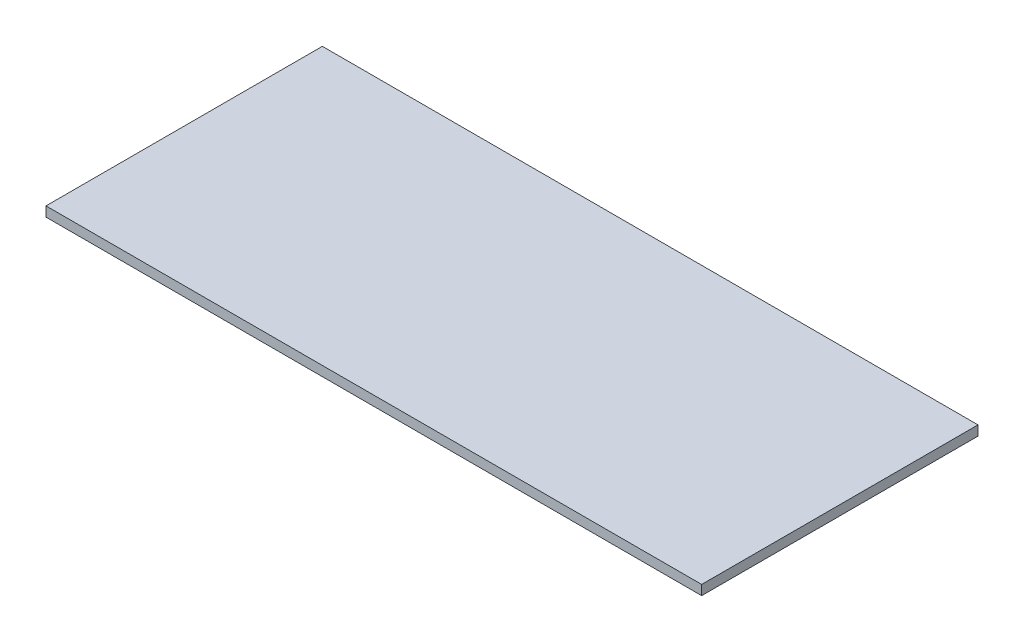
from build123d import *

# Parameters (mm, degrees)
ESQUISSE1_W        = 1210
ESQUISSE1_H        = 510
BOSS_EXTRU_1_DEPTH = 18


with BuildPart() as part:
    # Esquisse1 → Boss.-Extru.1 (new body)
    with BuildSketch(Plane(origin=(0, 0, 0), x_dir=(1, 0, 0), z_dir=(0, 1, 0))):
        Rectangle(ESQUISSE1_W, ESQUISSE1_H)
    extrude(amount=BOSS_EXTRU_1_DEPTH)


solid = part.part
